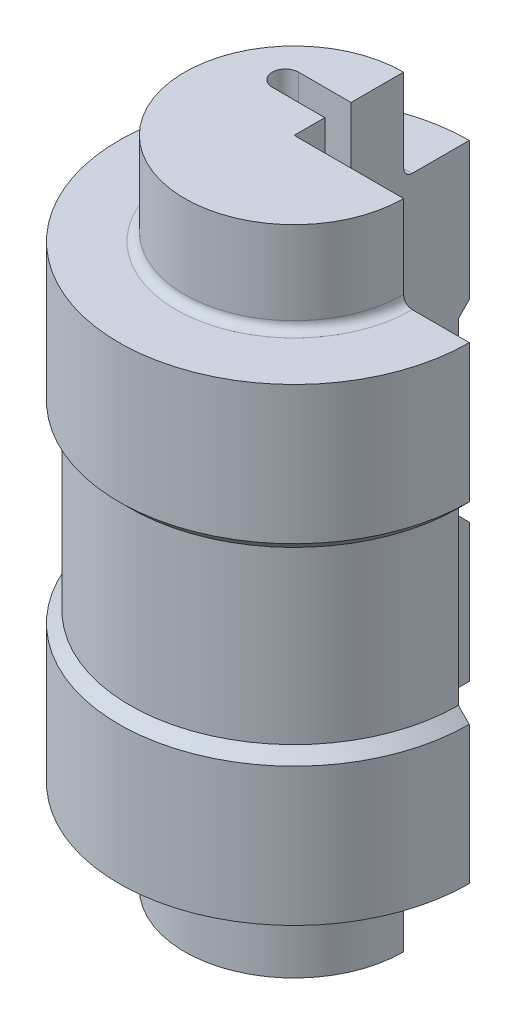
from build123d import *

# Parameters (mm, degrees)
SKETCH1_R               = 40
BOSS_EXTRUDE1_DEPTH     = 74.5
SKETCH3_R               = 40
SKETCH3_R_2             = 25
CUT_EXTRUDE1_DEPTH      = 21
CUT_EXTRUDE2_DEPTH      = 22
CUT_EXTRUDE2_DEPTH_BACK = 22
SKETCH2_R               = 40
SKETCH2_R_2             = 37.5
CUT_EXTRUDE4_DEPTH      = 160.376911753
FILLET1_R               = 2
CUT_EXTRUDE5_DEPTH      = 160.376911753


with BuildPart() as part:
    # Sketch1 → Boss-Extrude1 (new, symmetric)
    with BuildSketch(Plane(origin=(0, 0, 0), x_dir=(1, 0, 0), z_dir=(0, 1, 0))):
        with Locations(Location((0, 0, 0), (0, 0, 270))):
            Circle(SKETCH1_R)
    extrude(amount=BOSS_EXTRUDE1_DEPTH, both=True)

    # Sketch3 → Cut-Extrude1 (cut)
    with BuildSketch(Plane(origin=(0, 74.5, 0), x_dir=(1, 0, 0), z_dir=(0, 1, 0))):
        with Locations(Location((0, 0, 0), (0, 0, 270))):
            Circle(SKETCH3_R)
        with Locations(Location((0, 0, 0), (0, 0, 270))):
            Circle(SKETCH3_R_2, mode=Mode.SUBTRACT)
    cut_extrude1 = extrude(amount=-CUT_EXTRUDE1_DEPTH, mode=Mode.SUBTRACT)

    # Mirror1: Cut-Extrude1 across plane
    add(cut_extrude1.mirror(Plane.ZX), mode=Mode.SUBTRACT)

    # Sketch2 → Cut-Extrude2 (cut, two sides: drawn at the far end of the back side and taken through both)
    with BuildSketch(Plane(origin=(0, 0, 0), x_dir=(1, 0, 0), z_dir=(0, 1, 0)).offset(-CUT_EXTRUDE2_DEPTH_BACK)):
        with Locations(Location((0, 0, 0), (0, 0, 270))):
            Circle(SKETCH2_R)
        with Locations(Location((0, 0, 0), (0, 0, 90))):
            Circle(SKETCH2_R_2, mode=Mode.SUBTRACT)
    extrude(amount=CUT_EXTRUDE2_DEPTH + CUT_EXTRUDE2_DEPTH_BACK, mode=Mode.SUBTRACT)

    # Sketch5 → Cut-Extrude4 (cut, through all)
    with BuildSketch(Plane(origin=(0, 74.5, 0), x_dir=(1, 0, 0), z_dir=(0, 1, 0))):
        with BuildLine():
            Line((-12, 13), (12, 13))
            ThreePointArc((12, 13), (15, 10), (12, 7))
            Line((12, 7), (-12, 7))
            ThreePointArc((-12, 7), (-15, 10), (-12, 13))
        make_face()
    extrude(amount=-CUT_EXTRUDE4_DEPTH, mode=Mode.SUBTRACT)

    # Fillet1
    fillet1_edges = [part.edges().sort_by_distance(p)[0] for p in [
        (0, -53.5, -25),
        (0, 53.5, -25),
    ]]
    fillet(fillet1_edges, radius=FILLET1_R)

    # Sketch7 → Revolve2 (revolve)
    with BuildSketch(Plane(origin=(0, 0, 0), x_dir=(0, 0, -1), z_dir=(1, 0, 0))):
        Polygon((40, 22), (37.5, 19.5), (37.5, 22), align=None)
    revolve2 = revolve(axis=Axis((0, 103.881416882, 0), (0, -1, 0)))

    # Mirror2: Revolve2 across plane
    add(revolve2.mirror(Plane.ZX))

    # Sketch4 → Cut-Extrude5 (cut, through all)
    with BuildSketch(Plane(origin=(0, 74.5, 0), x_dir=(1, 0, 0), z_dir=(0, 1, 0))):
        with BuildLine():
            Line((0, 0), (0, 40))
            ThreePointArc((0, 40), (28.284271247, 28.284271247), (40, 0))
            Line((40, 0), (0, 0))
        make_face()
    extrude(amount=-CUT_EXTRUDE5_DEPTH, mode=Mode.SUBTRACT)


solid = part.part
